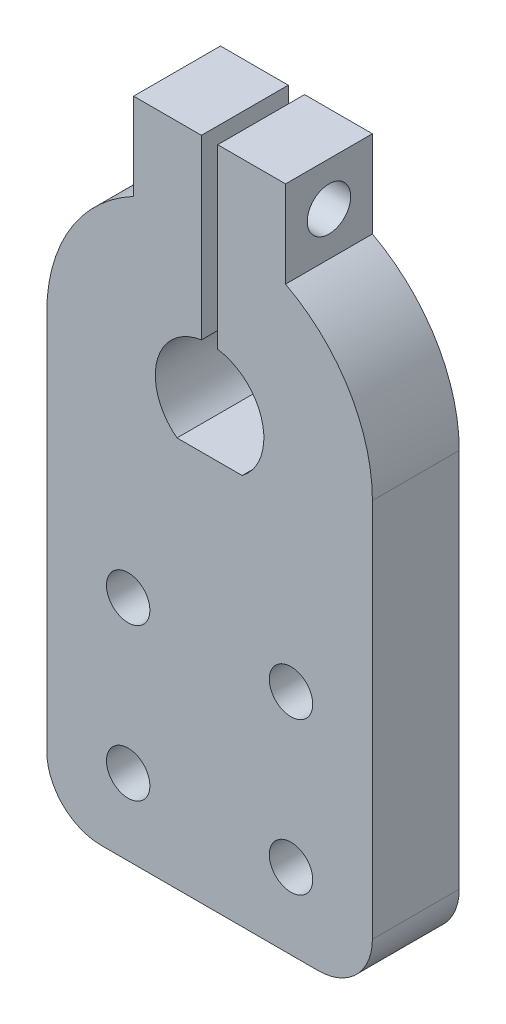
from build123d import *

# Parameters (mm, degrees)
SKETCH_1_R          = 2
EXTRUDE_1_DEPTH     = 8
SKETCH_2_R          = 2
CUT_EXTRUDE_1_DEPTH = 15
FILLET_2_R          = 5


with BuildPart() as part:
    # 草图1 → 凸台-拉伸1 (new body)
    with BuildSketch(Plane.XY):
        with BuildLine():
            Line((-15, 0), (-15, -40))
            Line((-15, -40), (15, -40))
            Line((15, -40), (15, 0))
            ThreePointArc((15, 0), (12.845232579, 7.745966692), (7, 13.266499161))
            Line((7, 13.266499161), (7, 21.266499161))
            Line((7, 21.266499161), (0.75, 21.266499161))
            Line((0.75, 21.266499161), (0.75, 4.943429983))
            ThreePointArc((0.75, 4.943429983), (4.848902965, 1.219893452), (3, -4))
            Line((3, -4), (-3, -4))
            ThreePointArc((-3, -4), (-4.848902965, 1.219893452), (-0.75, 4.943429983))
            Line((-0.75, 4.943429983), (-0.75, 21.266499161))
            Line((-0.75, 21.266499161), (-7, 21.266499161))
            Line((-7, 21.266499161), (-7, 13.266499161))
            ThreePointArc((-7, 13.266499161), (-12.845232579, 7.745966692), (-15, 0))
        make_face()
        with Locations((-7.5, -19)):
            Circle(SKETCH_1_R, mode=Mode.SUBTRACT)
        with Locations((-7.5, -33)):
            Circle(SKETCH_1_R, mode=Mode.SUBTRACT)
        with Locations(Location((7.5, -33, 0), (0, 0, 180))):
            Circle(SKETCH_1_R, mode=Mode.SUBTRACT)
        with Locations(Location((7.5, -19, 0), (0, 0, 180))):
            Circle(SKETCH_1_R, mode=Mode.SUBTRACT)
    extrude(amount=EXTRUDE_1_DEPTH)

    # 草图2 → 切除-拉伸1 (cut)
    with BuildSketch(Plane(origin=(7, 0, 0), x_dir=(0, 0, -1), z_dir=(1, 0, 0))):
        with Locations((-4, 17.266499161)):
            Circle(SKETCH_2_R)
    extrude(amount=-CUT_EXTRUDE_1_DEPTH, mode=Mode.SUBTRACT)

    # 圆角2
    fillet_2_edges = [part.edges().sort_by_distance(p)[0] for p in [
        (15, -40, 4),
        (-15, -40, 4),
    ]]
    fillet(fillet_2_edges, radius=FILLET_2_R)


solid = part.part
